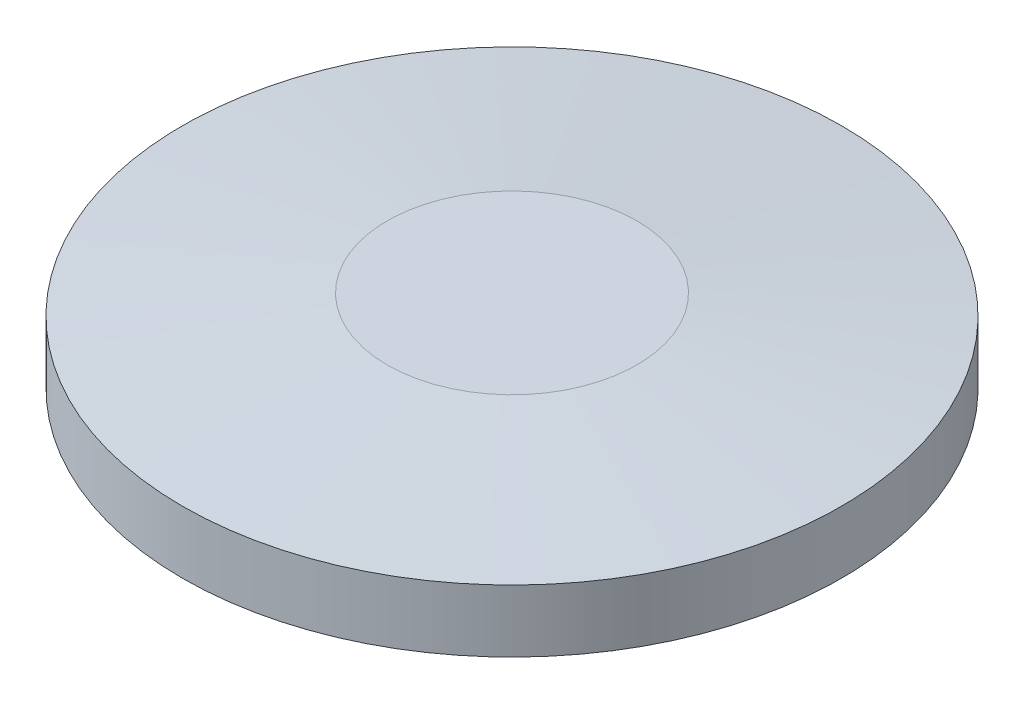
from build123d import *


with BuildPart() as part:
    # Sketch1 → Revolve1 (revolve)
    with BuildSketch(Plane(origin=(0, 0, 0), x_dir=(0, 0, -1), z_dir=(1, 0, 0))):
        Polygon((19.8, -0.25), (19.8, 3.5), (7.5, 4.7), (0, 4.7), (0, 0.25), (18.4, 0.25), (18.4, -0.25), align=None)
    revolve(axis=Axis((0, 0, 0), (0, 1, 0)))


solid = part.part
